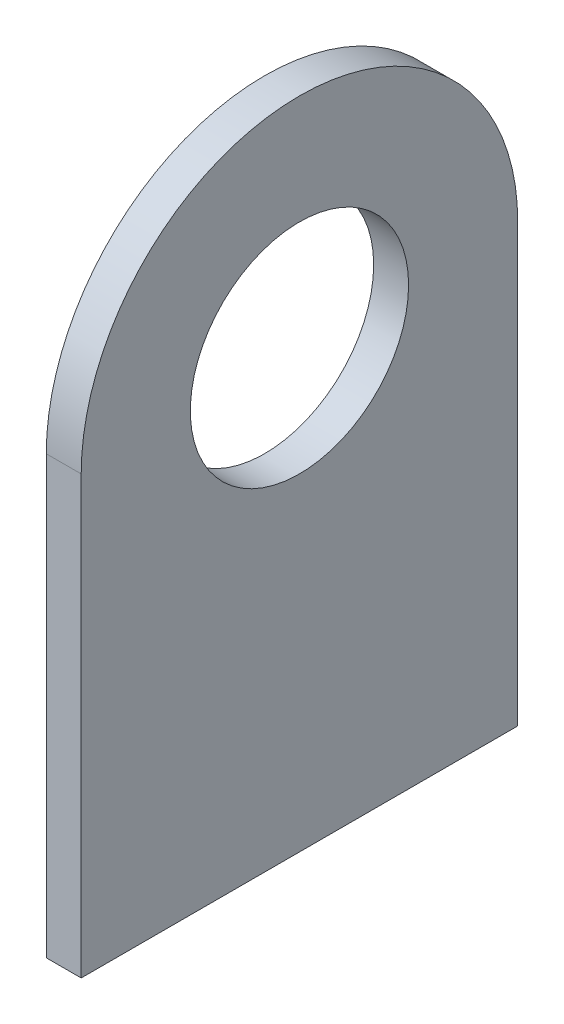
from build123d import *

# Parameters (mm, degrees)
SKETCH_1_R      = 25
EXTRUDE_1_DEPTH = 4


with BuildPart() as part:
    # 草图1 → 凸台-拉伸1 (new, symmetric)
    with BuildSketch(Plane(origin=(0, 0, 0), x_dir=(0, 0, -1), z_dir=(1, 0, 0))):
        with BuildLine():
            Line((-50, 0), (50, 0))
            Line((50, 0), (50, 100))
            ThreePointArc((50, 100), (0, 150), (-50, 100))
            Line((-50, 100), (-50, 0))
        make_face()
        with Locations((0, 100)):
            Circle(SKETCH_1_R, mode=Mode.SUBTRACT)
    extrude(amount=EXTRUDE_1_DEPTH, both=True)


solid = part.part
